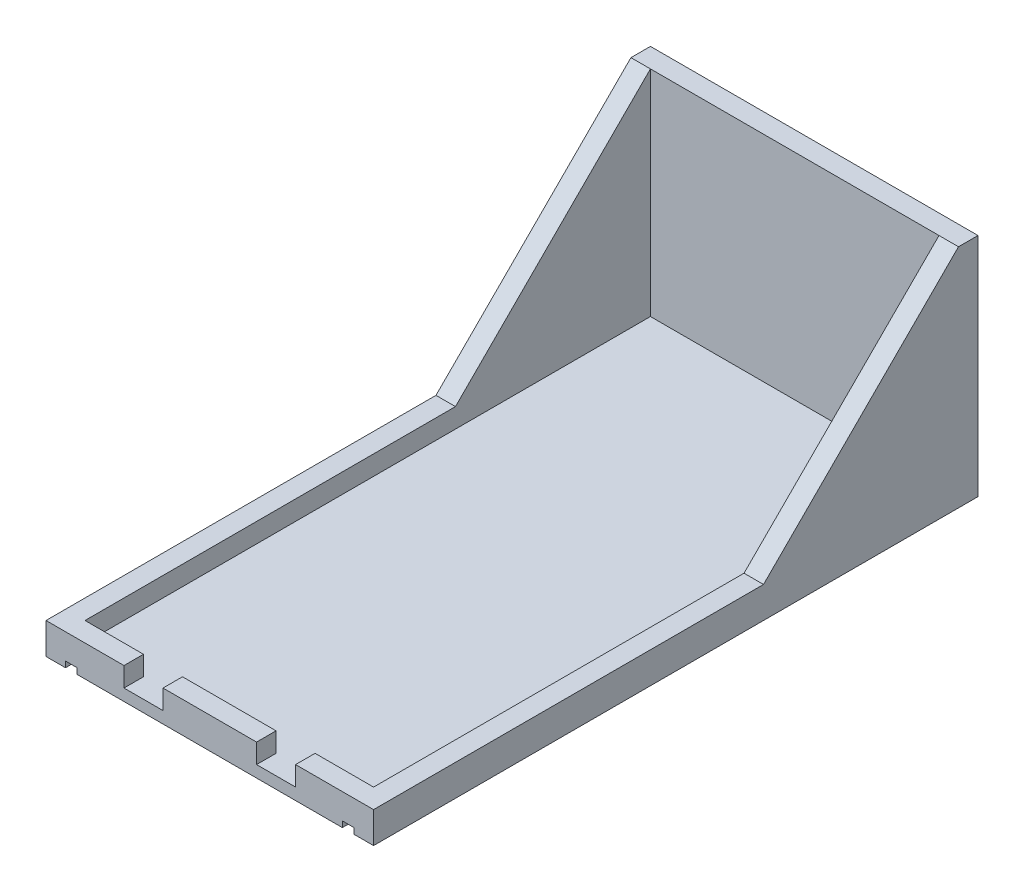
from build123d import *

# Parameters (mm, degrees)
SKETCH1_W           = 84
SKETCH1_H           = 155
BOSS_EXTRUDE1_DEPTH = 3
SKETCH2_W           = 3
SKETCH2_H           = 3
CUT_EXTRUDE1_DEPTH  = 3
SKETCH3_W           = 5
SKETCH3_H           = 8
BOSS_EXTRUDE2_DEPTH = 155
SKETCH4_W           = 5
SKETCH4_H           = 8
BOSS_EXTRUDE3_DEPTH = 155
SKETCH5_W           = 5
SKETCH5_H           = 58
BOSS_EXTRUDE4_DEPTH = 84
BOSS_EXTRUDE5_DEPTH = 5
BOSS_EXTRUDE6_DEPTH = 5
SKETCH8_W           = 84
SKETCH8_H           = 8
BOSS_EXTRUDE8_DEPTH = 5
SKETCH10_W          = 10
SKETCH10_H          = 7.49718506
CUT_EXTRUDE2_DEPTH  = 5
SKETCH11_W          = 10
SKETCH11_H          = 10.666578164
CUT_EXTRUDE3_DEPTH  = 5
SKETCH12_W          = 2.991300293
SKETCH12_H          = 5
CUT_EXTRUDE4_DEPTH  = 1.5
CUT_EXTRUDE5_DEPTH  = 1.5


with BuildPart() as part:
    # Sketch1 → Boss-Extrude1 (new body)
    with BuildSketch(Plane(origin=(0, 0, 0), x_dir=(1, 0, 0), z_dir=(0, 1, 0))):
        Rectangle(SKETCH1_W, SKETCH1_H)
    extrude(amount=BOSS_EXTRUDE1_DEPTH)

    # Sketch2 → Cut-Extrude1 (cut)
    with BuildSketch(Plane(origin=(0, 3, 0), x_dir=(1, 0, 0), z_dir=(0, 1, 0))):
        with Locations((35.5, -71)):
            Rectangle(SKETCH2_W, SKETCH2_H)
        with Locations((-35.5, -71)):
            Rectangle(SKETCH2_W, SKETCH2_H)
    extrude(amount=-CUT_EXTRUDE1_DEPTH, mode=Mode.SUBTRACT)

    # Sketch3 → Boss-Extrude2 (add)
    with BuildSketch(Plane.XY.offset(77.5)):
        with Locations((39.5, 4)):
            Rectangle(SKETCH3_W, SKETCH3_H)
    extrude(amount=-BOSS_EXTRUDE2_DEPTH)

    # Sketch4 → Boss-Extrude3 (add)
    with BuildSketch(Plane.XY.offset(77.5)):
        with Locations((-39.5, 4)):
            Rectangle(SKETCH4_W, SKETCH4_H)
    extrude(amount=-BOSS_EXTRUDE3_DEPTH)

    # Sketch5 → Boss-Extrude4 (add)
    with BuildSketch(Plane.ZY.offset(42)):
        with Locations((-75, 29)):
            Rectangle(SKETCH5_W, SKETCH5_H)
    extrude(amount=-BOSS_EXTRUDE4_DEPTH)

    # Sketch6 → Boss-Extrude5 (add)
    with BuildSketch(Plane.ZY.offset(42)):
        Polygon((-72.5, 58), (-22.5, 8), (-74.300026141, 4.41684906), (-74.300026141, 56.199973859), align=None)
    extrude(amount=-BOSS_EXTRUDE5_DEPTH)

    # Sketch7 → Boss-Extrude6 (add)
    with BuildSketch(Plane(origin=(42, 0, 0), x_dir=(0, 0, -1), z_dir=(1, 0, 0))):
        Polygon((72.5, 58), (19.108860597, 4.608860597), (75.247556584, 4.608860597), (75.247556584, 53.916409465), align=None)
    extrude(amount=-BOSS_EXTRUDE6_DEPTH)

    # Sketch8 → Boss-Extrude8 (add)
    with BuildSketch(Plane.XY.offset(77.5)):
        with Locations((0, 4)):
            Rectangle(SKETCH8_W, SKETCH8_H)
    extrude(amount=-BOSS_EXTRUDE8_DEPTH)

    # Sketch10 → Cut-Extrude2 (cut)
    with BuildSketch(Plane.XY.offset(77.5)):
        with Locations((-17, 6.74859253)):
            Rectangle(SKETCH10_W, SKETCH10_H)
    extrude(amount=-CUT_EXTRUDE2_DEPTH, mode=Mode.SUBTRACT)

    # Sketch11 → Cut-Extrude3 (cut)
    with BuildSketch(Plane.XY.offset(77.5)):
        with Locations((17, 8.333289082)):
            Rectangle(SKETCH11_W, SKETCH11_H)
    extrude(amount=-CUT_EXTRUDE3_DEPTH, mode=Mode.SUBTRACT)

    # Sketch12 → Cut-Extrude4 (cut)
    with BuildSketch(Plane(origin=(0, 0, 0), x_dir=(-1, 0, 0), z_dir=(0, -1, 0))):
        with Locations((35.504349854, -75)):
            Rectangle(SKETCH12_W, SKETCH12_H)
    extrude(amount=-CUT_EXTRUDE4_DEPTH, mode=Mode.SUBTRACT)

    # Sketch13 → Cut-Extrude5 (cut)
    with BuildSketch(Plane(origin=(0, 0, 0), x_dir=(-1, 0, 0), z_dir=(0, -1, 0))):
        Polygon((-34, -72.5), (-34, -80.193887821), (-37, -80.075389367), (-37, -72.5), align=None)
    extrude(amount=-CUT_EXTRUDE5_DEPTH, mode=Mode.SUBTRACT)


solid = part.part
